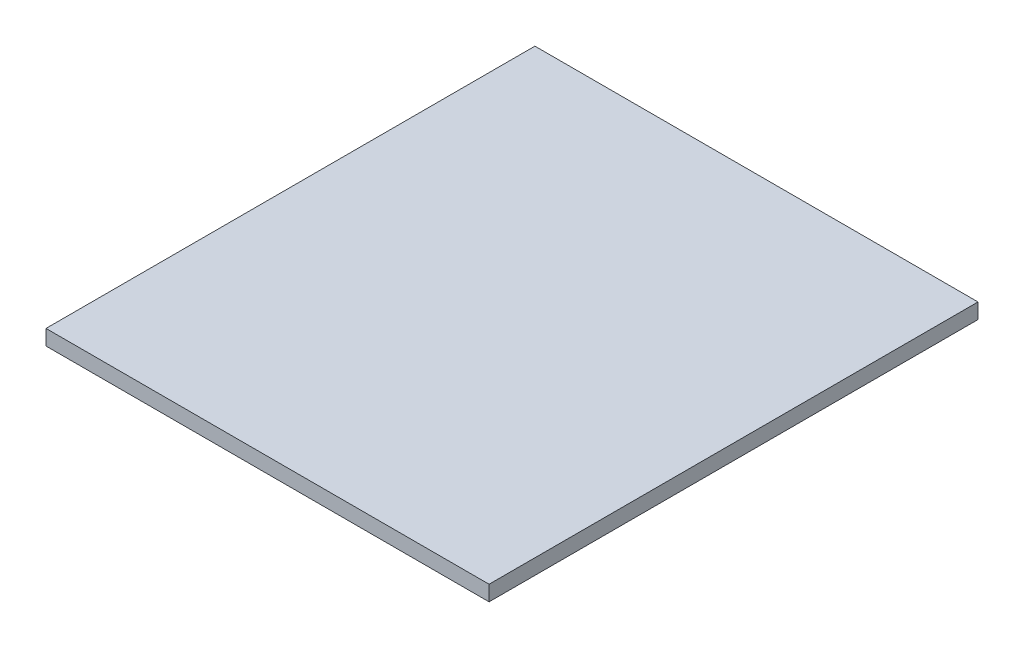
from build123d import *

# Parameters (mm, degrees)
SKETCH_1_W        = 290
SKETCH_1_H        = 320
EXTRUDE_322_DEPTH = 10


with BuildPart() as part:
    # Эскиз1 → Extrude 322 (new body)
    with BuildSketch(Plane(origin=(0, 0, 0), x_dir=(1, 0, 0), z_dir=(0, 1, 0))):
        with Locations((145, 160)):
            Rectangle(SKETCH_1_W, SKETCH_1_H)
    extrude(amount=EXTRUDE_322_DEPTH)


solid = part.part
